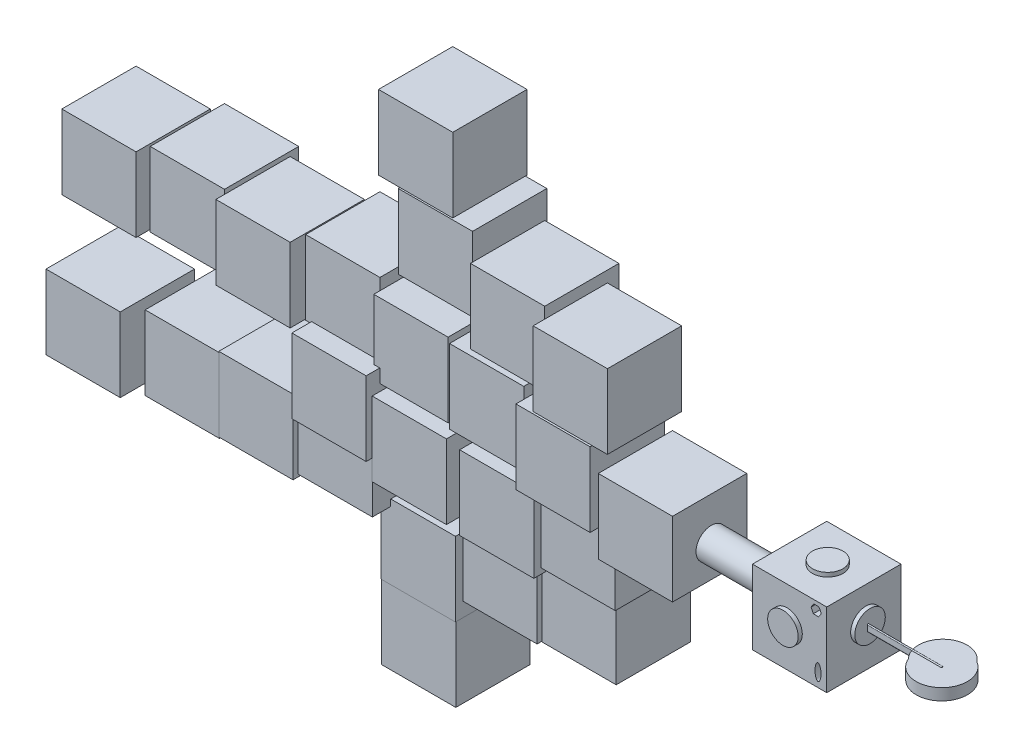
from build123d import *

# Parameters (mm, degrees)
SKETCH1_W                = 90
SKETCH1_H                = 90
BOSS_EXTRUDE1_DEPTH      = 90
BOSS_EXTRUDE2_DEPTH      = 5
BOSS_EXTRUDE2_DEPTH_BACK = 90
SKETCH2_R                = 18.495149705
BOSS_EXTRUDE3_DEPTH      = 5
BOSS_EXTRUDE3_DEPTH_BACK = 90
SKETCH3_R                = 18.495149705
BOSS_EXTRUDE4_DEPTH      = 5
BOSS_EXTRUDE4_DEPTH_BACK = 90
SKETCH4_R                = 18.495149705
BOSS_EXTRUDE5_DEPTH      = 95.671853643
BOSS_EXTRUDE5_DEPTH_BACK = 90
SKETCH5_R                = 18.495149705
BOSS_EXTRUDE6_DEPTH      = 5
BOSS_EXTRUDE6_DEPTH_BACK = 90
SKETCH6_R                = 18.495149705
CUT_EXTRUDE1_DEPTH       = 90
SKETCH8_RX               = 9.776430477
SKETCH8_RY               = 3.640340221
CUT_EXTRUDE2_DEPTH       = 90
BOSS_EXTRUDE7_DEPTH      = 90
SKETCH10_R               = 29.435529535
SKETCH10_R_2             = 31.00879633
BOSS_EXTRUDE10_DEPTH     = 14
SKETCH11_W               = 90
SKETCH11_H               = 90
BOSS_EXTRUDE11_DEPTH     = 90
SKETCH15_W               = 90
SKETCH15_H               = 90
BOSS_EXTRUDE13_DEPTH     = 90
SKETCH17_W               = 90
SKETCH17_H               = 90
BOSS_EXTRUDE15_DEPTH     = 90
SKETCH18_W               = 90
SKETCH18_H               = 90
BOSS_EXTRUDE16_DEPTH     = 90
SKETCH19_W               = 90
SKETCH19_H               = 90
BOSS_EXTRUDE17_DEPTH     = 90
SKETCH20_W               = 90
SKETCH20_H               = 90
BOSS_EXTRUDE18_DEPTH     = 90
SKETCH21_W               = 90
SKETCH21_H               = 90
BOSS_EXTRUDE19_DEPTH     = 90
SKETCH22_W               = 90
SKETCH22_H               = 90
BOSS_EXTRUDE20_DEPTH     = 90
SKETCH23_W               = 90
SKETCH23_H               = 90
BOSS_EXTRUDE21_DEPTH     = 90
SKETCH24_W               = 90
SKETCH24_H               = 90
BOSS_EXTRUDE22_DEPTH     = 90
SKETCH25_W               = 90
SKETCH25_H               = 90
BOSS_EXTRUDE23_DEPTH     = 90
SKETCH26_W               = 90
SKETCH26_H               = 90
BOSS_EXTRUDE24_DEPTH     = 90
SKETCH27_W               = 90
SKETCH27_H               = 90
BOSS_EXTRUDE25_DEPTH     = 90
SKETCH28_W               = 90
SKETCH28_H               = 90
BOSS_EXTRUDE26_DEPTH     = 90
SKETCH29_W               = 90
SKETCH29_H               = 90
BOSS_EXTRUDE27_DEPTH     = 90
SKETCH30_W               = 90
SKETCH30_H               = 90
BOSS_EXTRUDE28_DEPTH     = 90
SKETCH31_W               = 90
SKETCH31_H               = 90
BOSS_EXTRUDE29_DEPTH     = 90
SKETCH32_W               = 90
SKETCH32_H               = 90
BOSS_EXTRUDE30_DEPTH     = 90
SKETCH33_W               = 90
SKETCH33_H               = 90
BOSS_EXTRUDE31_DEPTH     = 90
SKETCH34_W               = 90
SKETCH34_H               = 90
BOSS_EXTRUDE32_DEPTH     = 90
SKETCH35_W               = 90
SKETCH35_H               = 90
BOSS_EXTRUDE33_DEPTH     = 90
SKETCH36_W               = 90
SKETCH36_H               = 90
BOSS_EXTRUDE34_DEPTH     = 90
SKETCH37_W               = 90
SKETCH37_H               = 90
BOSS_EXTRUDE35_DEPTH     = 90
SKETCH38_W               = 90
SKETCH38_H               = 90
BOSS_EXTRUDE36_DEPTH     = 90


with BuildPart() as part:
    # Sketch1 → Boss-Extrude1 (new body)
    with BuildSketch(Plane.XY):
        Rectangle(SKETCH1_W, SKETCH1_H)
    extrude(amount=BOSS_EXTRUDE1_DEPTH)

    # Sketch2 → Boss-Extrude2 (add, two sides: drawn at the far end of the back side and taken through both)
    with BuildSketch(Plane(origin=(45, 0, 0), x_dir=(0, 0, -1), z_dir=(1, 0, 0)).offset(-BOSS_EXTRUDE2_DEPTH_BACK)):
        with Locations(Location((-42.533520746, 3.735944486, 0), (0, 0, 270))):
            Circle(SKETCH2_R)
    extrude(amount=BOSS_EXTRUDE2_DEPTH + BOSS_EXTRUDE2_DEPTH_BACK)

    # Sketch3 → Boss-Extrude3 (add, two sides: drawn at the far end of the back side and taken through both)
    with BuildSketch(Plane.XY.offset(90).offset(-BOSS_EXTRUDE3_DEPTH_BACK)):
        with Locations((-3.126781539, 1.624320901)):
            Circle(SKETCH3_R)
    extrude(amount=BOSS_EXTRUDE3_DEPTH + BOSS_EXTRUDE3_DEPTH_BACK)

    # Sketch4 → Boss-Extrude4 (add, two sides: drawn at the far end of the back side and taken through both)
    with BuildSketch(Plane(origin=(0, 45, 0), x_dir=(0, 0, -1), z_dir=(0, 1, 0)).offset(-BOSS_EXTRUDE4_DEPTH_BACK)):
        with Locations((-44.963029761, -1.140691585)):
            Circle(SKETCH4_R)
    extrude(amount=BOSS_EXTRUDE4_DEPTH + BOSS_EXTRUDE4_DEPTH_BACK)

    # Sketch5 → Boss-Extrude5 (add, two sides: drawn at the far end of the back side and taken through both)
    with BuildSketch(Plane.ZY.offset(45).offset(-BOSS_EXTRUDE5_DEPTH_BACK)):
        with Locations(Location((44.323215706, -3.480744369, 0), (0, 0, 90))):
            Circle(SKETCH5_R)
    extrude(amount=BOSS_EXTRUDE5_DEPTH + BOSS_EXTRUDE5_DEPTH_BACK)

    # Sketch6 → Boss-Extrude6 (add, two sides: drawn at the far end of the back side and taken through both)
    with BuildSketch(Plane(origin=(0, -45, 0), x_dir=(0, 0, -1), z_dir=(0, -1, 0)).offset(-BOSS_EXTRUDE6_DEPTH_BACK)):
        with Locations(Location((-43.114009277, -1.073204684, 0), (0, 0, 180))):
            Circle(SKETCH6_R)
    extrude(amount=BOSS_EXTRUDE6_DEPTH + BOSS_EXTRUDE6_DEPTH_BACK)

    # Sketch7 → Cut-Extrude1 (cut)
    with BuildSketch(Plane(origin=(0, 0, 0), x_dir=(-1, 0, 0), z_dir=(0, 0, -1))):
        Polygon((-28.802165797, 29.805616158), (-25.949050166, 35.352304143), (-29.326065052, 40.596518751), (-35.556195569, 40.294045375), (-38.4093112, 34.747357391), (-35.032296314, 29.503142782), align=None)
    extrude(amount=-CUT_EXTRUDE1_DEPTH, mode=Mode.SUBTRACT)

    # Sketch8 → Cut-Extrude2 (cut)
    with BuildSketch(Plane.XY.offset(90)):
        with Locations(Location((34.417640855, -28.6823815), (0, 0, -90))):
            Ellipse(SKETCH8_RX, SKETCH8_RY)
    extrude(amount=-CUT_EXTRUDE2_DEPTH, mode=Mode.SUBTRACT)

    # Sketch9 → Boss-Extrude7 (add)
    with BuildSketch(Plane(origin=(50, 0, 0), x_dir=(0, 0, -1), z_dir=(1, 0, 0))):
        with BuildLine():
            Line((-44.073528041, 6.623037359), (-44.073528041, 0))
            ThreePointArc((-44.073528041, 0), (-44.987170795, -0.913642754), (-45.900813549, 0))
            Line((-45.900813549, 0), (-45.900813549, 6.623037359))
            ThreePointArc((-45.900813549, 6.623037359), (-44.987170795, 7.536680113), (-44.073528041, 6.623037359))
        make_face()
    extrude(amount=BOSS_EXTRUDE7_DEPTH)

    # Sketch10 → Boss-Extrude10 (add)
    with BuildSketch(Plane(origin=(140, 6.623037359, 44.073528041), x_dir=(1, 0, 0), z_dir=(0, 1, 0))):
        with Locations((-8.425763271, 8.188123623)):
            Circle(SKETCH10_R)
        with Locations((-0.853882083, -0.578401306)):
            Circle(SKETCH10_R_2)
    extrude(amount=-BOSS_EXTRUDE10_DEPTH)

    # Sketch11 → Boss-Extrude11 (add)
    with BuildSketch(Plane.ZY.offset(140.671853643)):
        with Locations((46.274660301, 3.007862201)):
            Rectangle(SKETCH11_W, SKETCH11_H)
    extrude(amount=BOSS_EXTRUDE11_DEPTH)

    # Sketch15 → Boss-Extrude13 (add)
    with BuildSketch(Plane.ZY.offset(230.671853643)):
        with Locations((56.117901354, 35.887776579)):
            Rectangle(SKETCH15_W, SKETCH15_H)
    extrude(amount=BOSS_EXTRUDE13_DEPTH)

    # Sketch17 → Boss-Extrude15 (add)
    with BuildSketch(Plane(origin=(0, -9.112223421, 0), x_dir=(0, 0, 1), z_dir=(0, -1, 0))):
        with Locations((32.944998673, 268.46400096)):
            Rectangle(SKETCH17_W, SKETCH17_H)
    extrude(amount=BOSS_EXTRUDE15_DEPTH)

    # Sketch18 → Boss-Extrude16 (add)
    with BuildSketch(Plane(origin=(0, -99.112223421, 0), x_dir=(0, 0, 1), z_dir=(0, -1, 0))):
        with Locations((20.205196721, 280.018389908)):
            Rectangle(SKETCH18_W, SKETCH18_H)
    extrude(amount=BOSS_EXTRUDE16_DEPTH)

    # Sketch19 → Boss-Extrude17 (add)
    with BuildSketch(Plane.ZX.offset(80.887776579)):
        with Locations((53.682033263, -257.191831861)):
            Rectangle(SKETCH19_W, SKETCH19_H)
    extrude(amount=BOSS_EXTRUDE17_DEPTH)

    # Sketch20 → Boss-Extrude18 (add)
    with BuildSketch(Plane.ZY.offset(320.671853643)):
        with Locations((46.604286047, 49.575930456)):
            Rectangle(SKETCH20_W, SKETCH20_H)
    extrude(amount=BOSS_EXTRUDE18_DEPTH)

    # Sketch21 → Boss-Extrude19 (add)
    with BuildSketch(Plane.ZY.offset(313.46400096)):
        with Locations((41.541737384, -60.925644917)):
            Rectangle(SKETCH21_W, SKETCH21_H)
    extrude(amount=BOSS_EXTRUDE19_DEPTH)

    # Sketch22 → Boss-Extrude20 (add)
    with BuildSketch(Plane.ZY.offset(325.018389908)):
        with Locations((26.015741577, -143.374246512)):
            Rectangle(SKETCH22_W, SKETCH22_H)
    extrude(amount=BOSS_EXTRUDE20_DEPTH)

    # Sketch23 → Boss-Extrude21 (add)
    with BuildSketch(Plane.ZY.offset(410.671853643)):
        with Locations((48.361022432, 57.107673426)):
            Rectangle(SKETCH23_W, SKETCH23_H)
    extrude(amount=BOSS_EXTRUDE21_DEPTH)

    # Sketch24 → Boss-Extrude22 (add)
    with BuildSketch(Plane.ZY.offset(403.46400096)):
        with Locations((57.557840509, -41.491797547)):
            Rectangle(SKETCH24_W, SKETCH24_H)
    extrude(amount=BOSS_EXTRUDE22_DEPTH)

    # Sketch25 → Boss-Extrude23 (add)
    with BuildSketch(Plane.ZY.offset(302.191831861)):
        with Locations((39.694926051, 139.471381828)):
            Rectangle(SKETCH25_W, SKETCH25_H)
    extrude(amount=BOSS_EXTRUDE23_DEPTH)

    # Sketch26 → Boss-Extrude24 (add)
    with BuildSketch(Plane.ZY.offset(415.018389908)):
        with Locations((35.08019354, -160.775987394)):
            Rectangle(SKETCH26_W, SKETCH26_H)
    extrude(amount=BOSS_EXTRUDE24_DEPTH)

    # Sketch27 → Boss-Extrude25 (add)
    with BuildSketch(Plane.ZY.offset(493.46400096)):
        with Locations((64.859071827, -16.636763853)):
            Rectangle(SKETCH27_W, SKETCH27_H)
    extrude(amount=BOSS_EXTRUDE25_DEPTH)

    # Sketch28 → Boss-Extrude26 (add)
    with BuildSketch(Plane.ZY.offset(500.671853643)):
        with Locations((40.962692617, 71.103775437)):
            Rectangle(SKETCH28_W, SKETCH28_H)
    extrude(amount=BOSS_EXTRUDE26_DEPTH)

    # Sketch29 → Boss-Extrude27 (add)
    with BuildSketch(Plane.ZY.offset(590.671853643)):
        with Locations((59.796772791, 72.436092304)):
            Rectangle(SKETCH29_W, SKETCH29_H)
    extrude(amount=BOSS_EXTRUDE27_DEPTH)

    # Sketch30 → Boss-Extrude28 (add)
    with BuildSketch(Plane.ZY.offset(493.46400096)):
        with Locations((57.292858656, -78.670768893)):
            Rectangle(SKETCH30_W, SKETCH30_H)
    extrude(amount=BOSS_EXTRUDE28_DEPTH)

    # Sketch31 → Boss-Extrude29 (add)
    with BuildSketch(Plane.ZY.offset(583.46400096)):
        with Locations((63.451538996, -81.570753098)):
            Rectangle(SKETCH31_W, SKETCH31_H)
    extrude(amount=BOSS_EXTRUDE29_DEPTH)

    # Sketch32 → Boss-Extrude30 (add)
    with BuildSketch(Plane.ZY.offset(680.671853643)):
        with Locations((49.382659113, 77.849427046)):
            Rectangle(SKETCH32_W, SKETCH32_H)
    extrude(amount=BOSS_EXTRUDE30_DEPTH)

    # Sketch33 → Boss-Extrude31 (add)
    with BuildSketch(Plane.ZY.offset(673.46400096)):
        with Locations((62.730555832, -83.439942723)):
            Rectangle(SKETCH33_W, SKETCH33_H)
    extrude(amount=BOSS_EXTRUDE31_DEPTH)

    # Sketch34 → Boss-Extrude32 (add)
    with BuildSketch(Plane.ZY.offset(770.671853643)):
        with Locations((66.535986151, 80.739967074)):
            Rectangle(SKETCH34_W, SKETCH34_H)
    extrude(amount=BOSS_EXTRUDE32_DEPTH)

    # Sketch35 → Boss-Extrude33 (add)
    with BuildSketch(Plane.ZY.offset(763.46400096)):
        with Locations((92.929039385, -70.503756327)):
            Rectangle(SKETCH35_W, SKETCH35_H)
    extrude(amount=BOSS_EXTRUDE33_DEPTH)

    # Sketch36 → Boss-Extrude34 (add)
    with BuildSketch(Plane(origin=(0, -205.775987394, 0), x_dir=(0, 0, 1), z_dir=(0, -1, 0))):
        with Locations((34.501194714, 460.115909211)):
            Rectangle(SKETCH36_W, SKETCH36_H)
    extrude(amount=BOSS_EXTRUDE34_DEPTH)

    # Sketch37 → Boss-Extrude35 (add)
    with BuildSketch(Plane.ZY.offset(392.191831861)):
        with Locations((37.153642439, 171.812234618)):
            Rectangle(SKETCH37_W, SKETCH37_H)
    extrude(amount=BOSS_EXTRUDE35_DEPTH)

    # Sketch38 → Boss-Extrude36 (add)
    with BuildSketch(Plane.ZX.offset(216.812234618)):
        with Locations((35.145451187, -463.193920459)):
            Rectangle(SKETCH38_W, SKETCH38_H)
    extrude(amount=BOSS_EXTRUDE36_DEPTH)


solid = part.part
